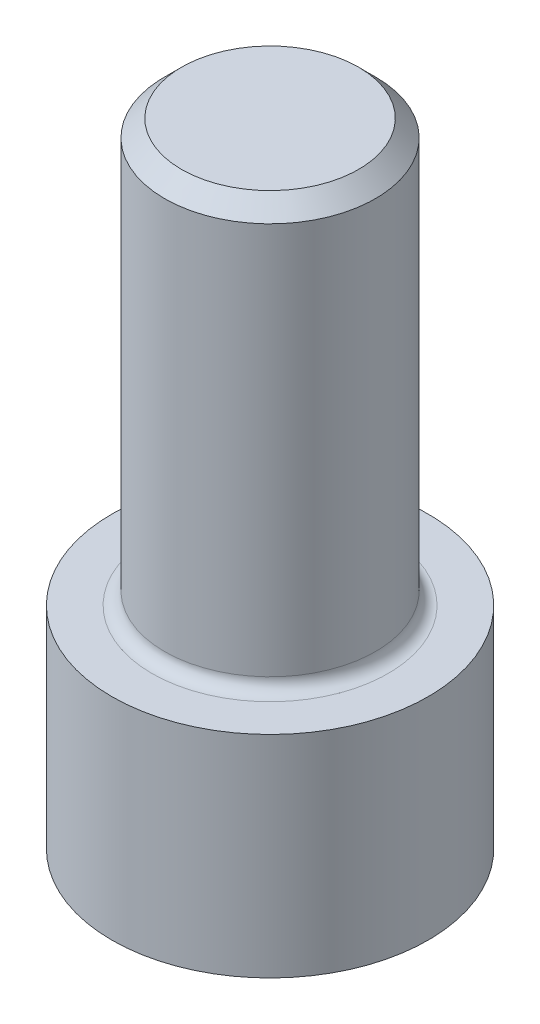
from build123d import *

# Parameters (mm, degrees)
SKETCH1_R           = 0.1875
BOSS_EXTRUDE1_DEPTH = 0.25
SKETCH2_R           = 0.125
BOSS_EXTRUDE2_DEPTH = 0.5
FILLET1_R           = 0.015
CHAMFER1_SIZE       = 0.02
CUT_EXTRUDE1_DEPTH  = 0.15


with BuildPart() as part:
    # Sketch1 → Boss-Extrude1 (new body)
    with BuildSketch(Plane(origin=(0, 0, 0), x_dir=(1, 0, 0), z_dir=(0, 1, 0))):
        with Locations(Location((0, 0, 0), (0, 0, 270))):
            Circle(SKETCH1_R)
    extrude(amount=BOSS_EXTRUDE1_DEPTH)

    # Sketch2 → Boss-Extrude2 (add)
    with BuildSketch(Plane(origin=(0, 0.25, 0), x_dir=(1, 0, 0), z_dir=(0, 1, 0))):
        with Locations(Location((0, 0, 0), (0, 0, 270))):
            Circle(SKETCH2_R)
    extrude(amount=BOSS_EXTRUDE2_DEPTH)

    # Fillet1
    fillet1_edges = [part.edges().sort_by_distance(p)[0] for p in [
        (0, 0.25, -0.125),
    ]]
    fillet(fillet1_edges, radius=FILLET1_R)

    # Chamfer1
    chamfer1_edges = [part.edges().sort_by_distance(p)[0] for p in [
        (0, 0.75, -0.125),
    ]]
    chamfer(chamfer1_edges, length=CHAMFER1_SIZE)

    # Sketch3 → Cut-Extrude1 (cut)
    with BuildSketch(Plane.XZ):
        Polygon((0.087524154, -0.048368611), (0.085650523, 0.051613835), (-0.001873631, 0.099982446), (-0.087524154, 0.048368611), (-0.085650523, -0.051613835), (0.001873631, -0.099982446), align=None)
    extrude(amount=-CUT_EXTRUDE1_DEPTH, mode=Mode.SUBTRACT)


solid = part.part
